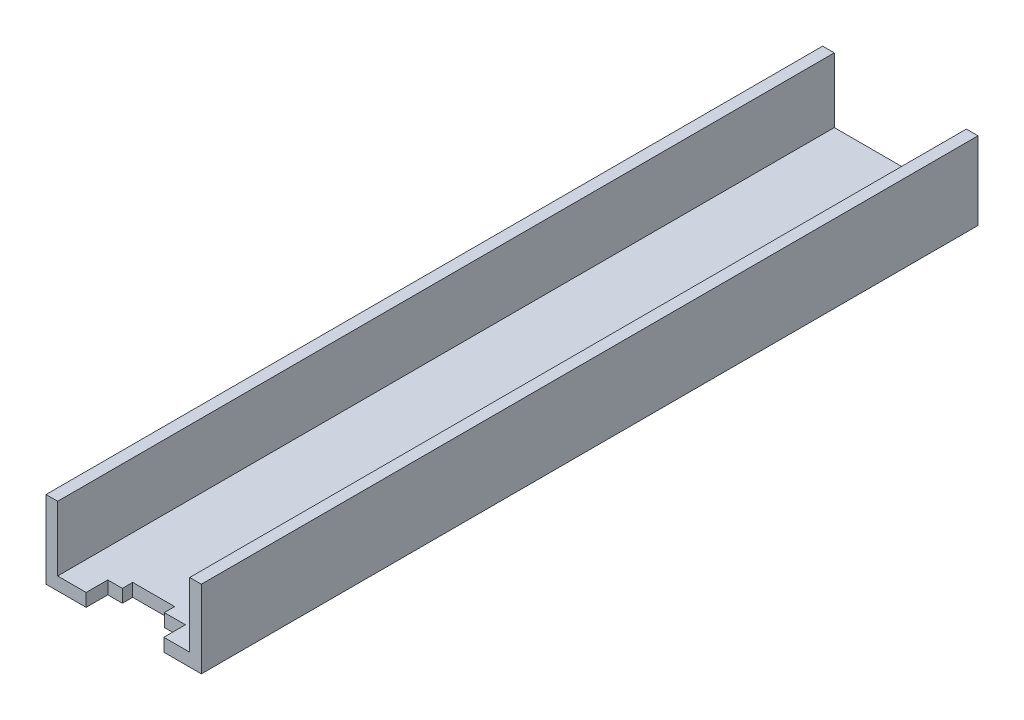
from build123d import *

# Parameters (mm, degrees)
SKETCH_1_W          = 6
SKETCH_1_H          = 3
EXTRUDE_1_DEPTH     = 30
SKETCH_4_W          = 5.1
SKETCH_4_H          = 2.5
CUT_EXTRUDE_1_DEPTH = 30
SKETCH_6_W          = 3
SKETCH_6_H          = 0.836449827
CUT_EXTRUDE_2_DEPTH = 0.5
SKETCH_8_W          = 1.62
SKETCH_8_H          = 0.4
CUT_EXTRUDE_3_DEPTH = 0.5


with BuildPart() as part:
    # 草圖1 → 填料-伸長1 (new body)
    with BuildSketch(Plane.XY):
        Rectangle(SKETCH_1_W, SKETCH_1_H)
    extrude(amount=EXTRUDE_1_DEPTH)

    # 草圖4 → 除料-伸長1 (cut)
    with BuildSketch(Plane.XY.offset(30)):
        with Locations((0, 0.25)):
            Rectangle(SKETCH_4_W, SKETCH_4_H)
    extrude(amount=-CUT_EXTRUDE_1_DEPTH, mode=Mode.SUBTRACT)

    # 草圖6 → 除料-伸長2 (cut)
    with BuildSketch(Plane(origin=(0, -1.5, 0), x_dir=(-1, 0, 0), z_dir=(0, -1, 0))):
        with Locations((-0.05, -29.581775087)):
            Rectangle(SKETCH_6_W, SKETCH_6_H)
    extrude(amount=-CUT_EXTRUDE_2_DEPTH, mode=Mode.SUBTRACT)

    # 草圖8 → 除料-伸長3 (cut)
    with BuildSketch(Plane(origin=(0, -1.5, 0), x_dir=(-1, 0, 0), z_dir=(0, -1, 0))):
        with Locations((0.076588476, -28.963550173)):
            Rectangle(SKETCH_8_W, SKETCH_8_H)
    extrude(amount=-CUT_EXTRUDE_3_DEPTH, mode=Mode.SUBTRACT)


solid = part.part
